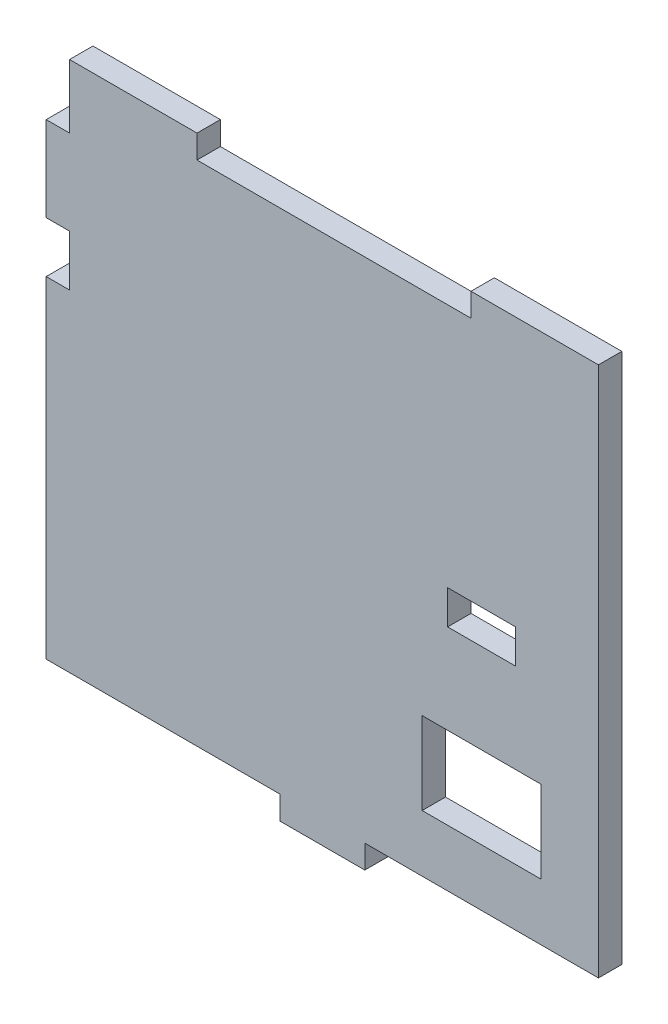
from build123d import *

# Parameters (mm, degrees)
CROQUIS1_W              = 28
CROQUIS1_H              = 19.35
CROQUIS1_W_2            = 16
CROQUIS1_H_2            = 8
SALIENTE_EXTRUIR1_DEPTH = 5.5


with BuildPart() as part:
    # Croquis1 → Saliente-Extruir1 (new body)
    with BuildSketch(Plane.XY):
        Polygon((468.016438709, 88.608229285), (468.016438709, -36.391770715), (413.016438709, -36.391770715), (413.016438709, -41.891770715), (393.016438709, -41.891770715), (393.016438709, -36.391770715), (338.016438709, -36.391770715), (338.016438709, 41.608229285), (343.516438709, 41.608229285), (343.516438709, 53.608229285), (338.016438709, 53.608229285), (338.016438709, 73.608229285), (343.516438709, 73.608229285), (343.516438709, 88.608229285), (373.516438709, 88.608229285), (373.516438709, 83.108229285), (438.016438709, 83.108229285), (438.016438709, 88.608229285), align=None)
        with Locations((440.516438709, -13.325)):
            Rectangle(CROQUIS1_W, CROQUIS1_H, mode=Mode.SUBTRACT)
        with Locations((440.516438709, 21.433223203)):
            Rectangle(CROQUIS1_W_2, CROQUIS1_H_2, mode=Mode.SUBTRACT)
    extrude(amount=SALIENTE_EXTRUIR1_DEPTH)


solid = part.part
